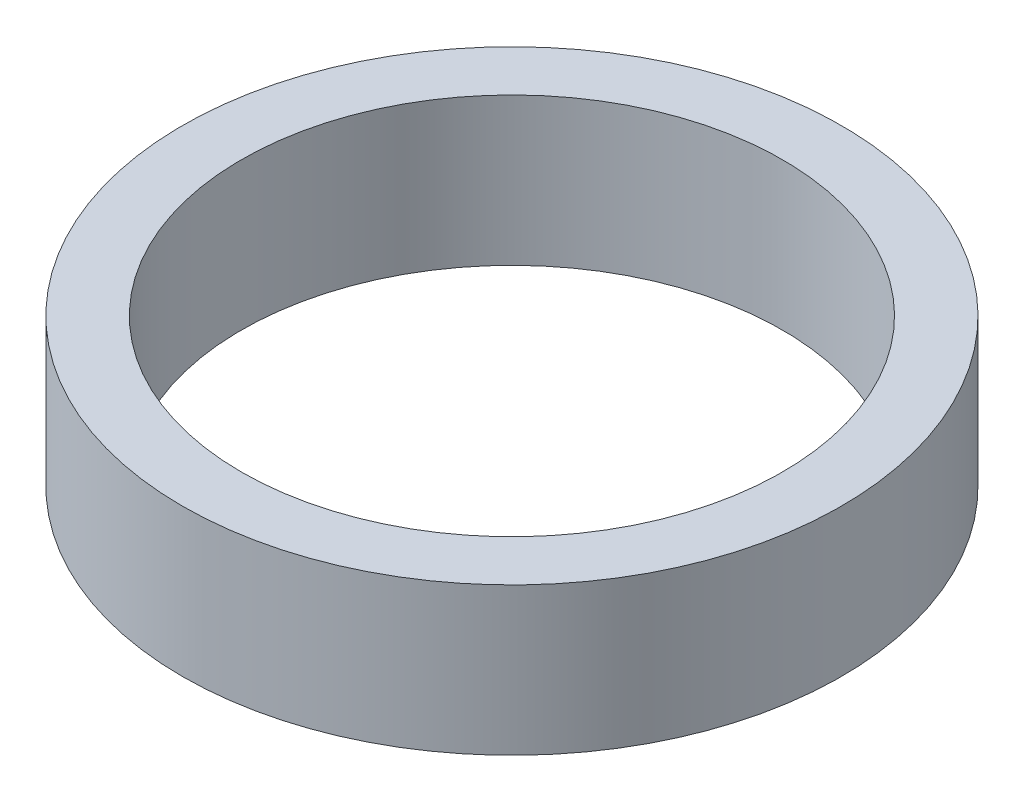
from build123d import *

# Parameters (mm, degrees)
SKETCH1_R           = 3.35
SKETCH1_R_2         = 2.75
BOSS_EXTRUDE1_DEPTH = 1.5


with BuildPart() as part:
    # Sketch1 → Boss-Extrude1 (new body)
    with BuildSketch(Plane(origin=(0, 0, 0), x_dir=(1, 0, 0), z_dir=(0, 1, 0))):
        with Locations(Location((0, 0, 0), (0, 0, 270))):
            Circle(SKETCH1_R)
        with Locations(Location((0, 0, 0), (0, 0, 270))):
            Circle(SKETCH1_R_2, mode=Mode.SUBTRACT)
    extrude(amount=BOSS_EXTRUDE1_DEPTH)


solid = part.part
